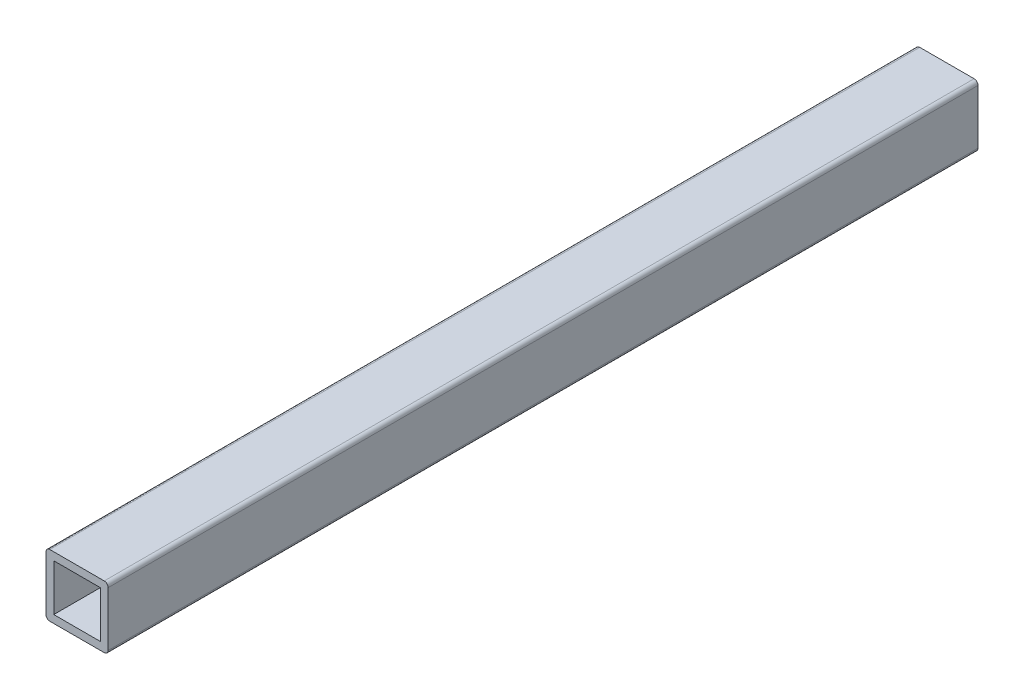
from build123d import *

# Parameters (mm, degrees)
BOSS_EXTRUDE1_DEPTH      = 88.9
BOSS_EXTRUDE1_DEPTH_BACK = 88.9
SKETCH1_W                = 12.7
SKETCH1_H                = 12.7
SKETCH1_W_2              = 9.525
SKETCH1_H_2              = 9.525
FILLET1_R                = 0.79375


with BuildPart() as part:
    # Sketch1 → Boss-Extrude1 (new, two sides: drawn at the far end of the back side and taken through both)
    with BuildSketch(Plane.XY.offset(-BOSS_EXTRUDE1_DEPTH_BACK)):
        Rectangle(SKETCH1_W, SKETCH1_H)
        Rectangle(SKETCH1_W_2, SKETCH1_H_2, mode=Mode.SUBTRACT)
    extrude(amount=BOSS_EXTRUDE1_DEPTH + BOSS_EXTRUDE1_DEPTH_BACK)

    # Fillet1
    fillet1_edges = [part.edges().sort_by_distance(p)[0] for p in [
        (6.35, -6.35, 0),
        (-6.35, -6.35, 0),
        (-6.35, 6.35, 0),
        (6.35, 6.35, 0),
    ]]
    fillet(fillet1_edges, radius=FILLET1_R)


solid = part.part
